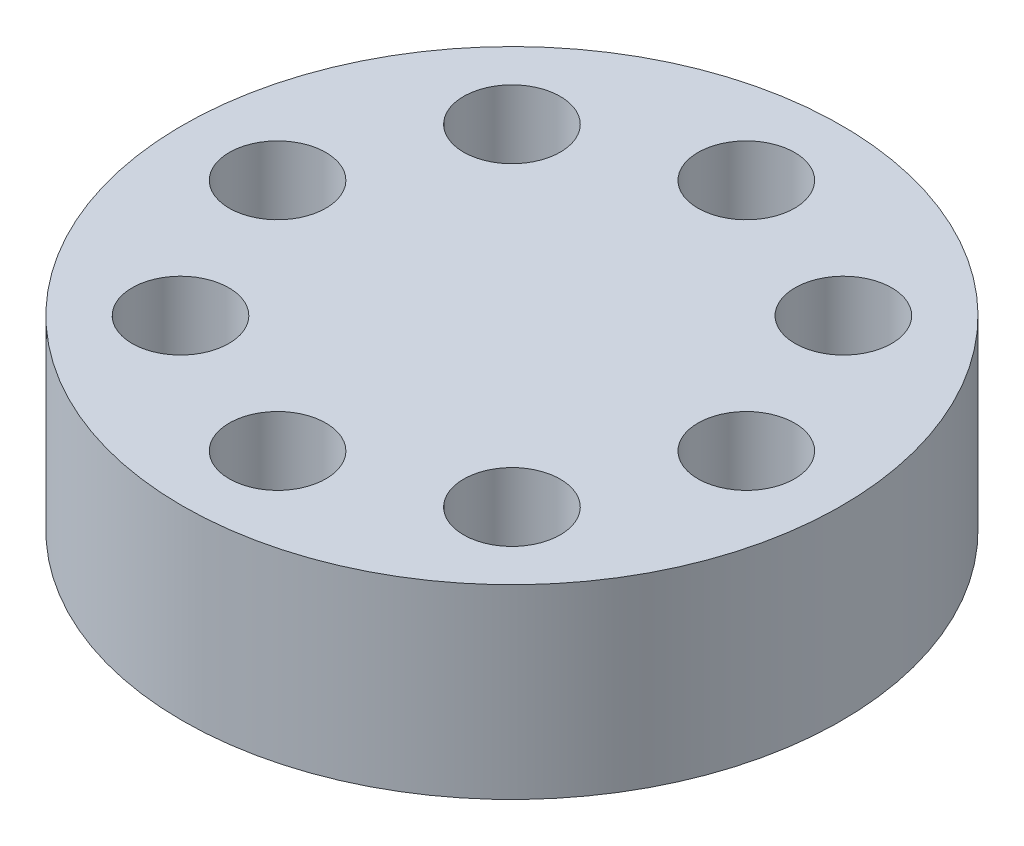
from build123d import *

# Parameters (mm, degrees)
SKETCH1_R           = 22.5
BOSS_EXTRUDE1_DEPTH = 12.7
SKETCH2_R           = 3.3
CUT_EXTRUDE1_DEPTH  = 35.260618792


with BuildPart() as part:
    # Sketch1 → Boss-Extrude1 (new body)
    with BuildSketch(Plane(origin=(0, 0, 0), x_dir=(1, 0, 0), z_dir=(0, 1, 0))):
        with Locations(Location((0, 0, 0), (0, 0, 270))):
            Circle(SKETCH1_R)
    extrude(amount=BOSS_EXTRUDE1_DEPTH)

    # Sketch2 → Cut-Extrude1 (cut, through all)
    with BuildSketch(Plane(origin=(0, 12.7, 0), x_dir=(1, 0, 0), z_dir=(0, 1, 0))):
        with Locations(Location((-16, 0, 0), (0, 0, 270))):
            Circle(SKETCH2_R)
        with Locations(Location((-11.313708499, 11.313708499, 0), (0, 0, 270))):
            Circle(SKETCH2_R)
        with Locations(Location((0, 16, 0), (0, 0, 270))):
            Circle(SKETCH2_R)
        with Locations(Location((11.313708499, 11.313708499, 0), (0, 0, 270))):
            Circle(SKETCH2_R)
        with Locations(Location((16, 0, 0), (0, 0, 270))):
            Circle(SKETCH2_R)
        with Locations(Location((11.313708499, -11.313708499, 0), (0, 0, 270))):
            Circle(SKETCH2_R)
        with Locations(Location((0, -16, 0), (0, 0, 270))):
            Circle(SKETCH2_R)
        with Locations(Location((-11.313708499, -11.313708499, 0), (0, 0, 270))):
            Circle(SKETCH2_R)
    extrude(amount=-CUT_EXTRUDE1_DEPTH, mode=Mode.SUBTRACT)


solid = part.part
